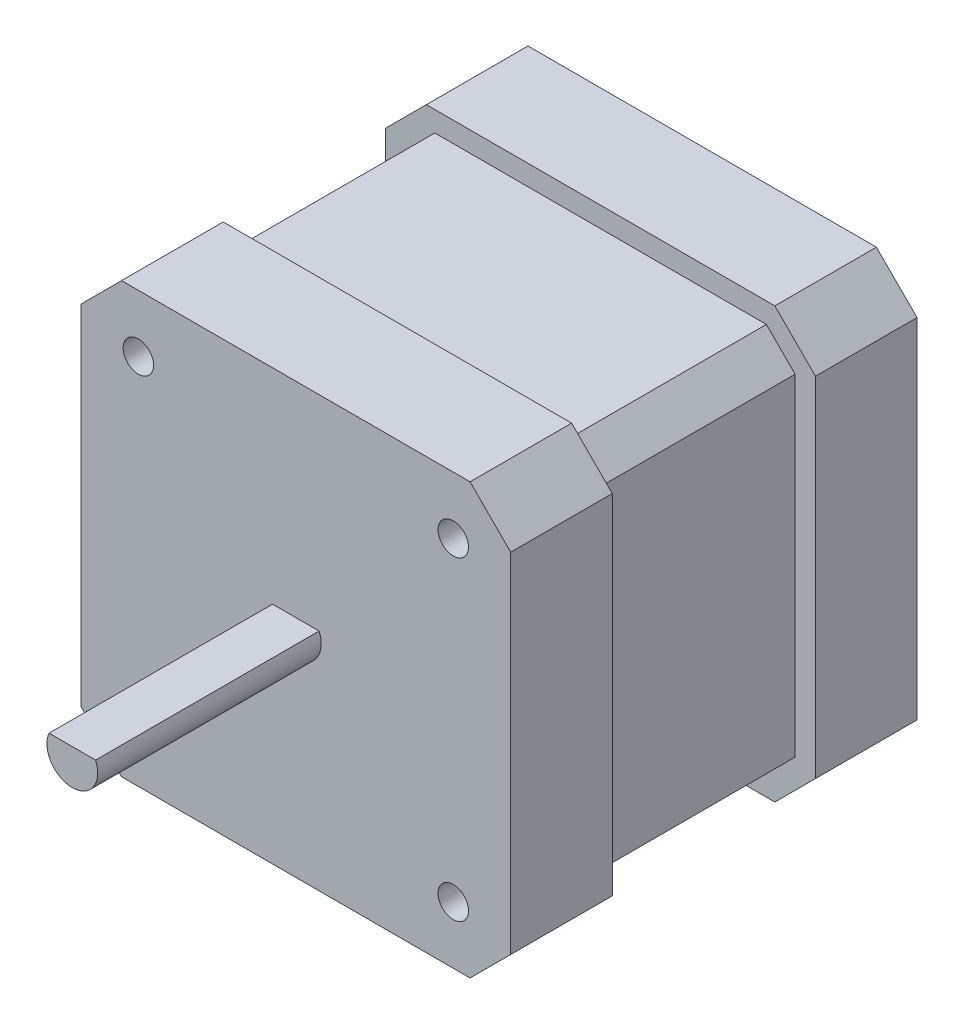
from build123d import *

# Parameters (mm, degrees)
BOSS_EXTRUDE1_DEPTH = 10
BOSS_EXTRUDE2_DEPTH = 20
BOSS_EXTRUDE3_DEPTH = 10
BOSS_EXTRUDE4_DEPTH = 22
SKETCH6_R           = 1.5
CUT_EXTRUDE1_DEPTH  = 4.5


with BuildPart() as part:
    # Sketch1 → Boss-Extrude1 (new body)
    with BuildSketch(Plane.XY):
        Polygon((-21.15, 17.15), (-17.15, 21.15), (17.15, 21.15), (21.15, 17.15), (21.15, -17.15), (17.15, -21.15), (-17.15, -21.15), (-21.15, -17.15), align=None)
    extrude(amount=BOSS_EXTRUDE1_DEPTH)

    # Sketch2 → Boss-Extrude2 (add)
    with BuildSketch(Plane(origin=(0, 0, 0), x_dir=(-1, 0, 0), z_dir=(0, 0, -1))):
        Polygon((19.15, 16.321572875), (16.321572875, 19.15), (-16.321572875, 19.15), (-19.15, 16.321572875), (-19.15, -16.321572875), (-16.321572875, -19.15), (16.321572875, -19.15), (19.15, -16.321572875), align=None)
    extrude(amount=BOSS_EXTRUDE2_DEPTH)

    # Sketch3 → Boss-Extrude3 (add)
    with BuildSketch(Plane(origin=(0, 0, -20), x_dir=(-1, 0, 0), z_dir=(0, 0, -1))):
        Polygon((21.15, 17.15), (17.15, 21.15), (-17.15, 21.15), (-21.15, 17.15), (-21.15, -17.15), (-17.15, -21.15), (17.15, -21.15), (21.15, -17.15), align=None)
    extrude(amount=BOSS_EXTRUDE3_DEPTH)

    # Sketch4 → Boss-Extrude4 (add)
    with BuildSketch(Plane.XY.offset(10)):
        with BuildLine():
            Line((2.291287847, 1), (-2.291287847, 1))
            ThreePointArc((-2.291287847, 1), (-0.510774109, -2.447265782), (2.5, 0))
            ThreePointArc((2.5, 0), (2.447265782, 0.510774109), (2.291287847, 1))
        make_face()
    extrude(amount=BOSS_EXTRUDE4_DEPTH)

    # Sketch6 → Cut-Extrude1 (cut)
    with BuildSketch(Plane.XY.offset(10)):
        with Locations((-15.5, 15.5)):
            Circle(SKETCH6_R)
        with Locations((15.5, 15.5)):
            Circle(SKETCH6_R)
        with Locations((15.5, -15.5)):
            Circle(SKETCH6_R)
        with Locations((-15.5, -15.5)):
            Circle(SKETCH6_R)
    extrude(amount=-CUT_EXTRUDE1_DEPTH, mode=Mode.SUBTRACT)


solid = part.part
